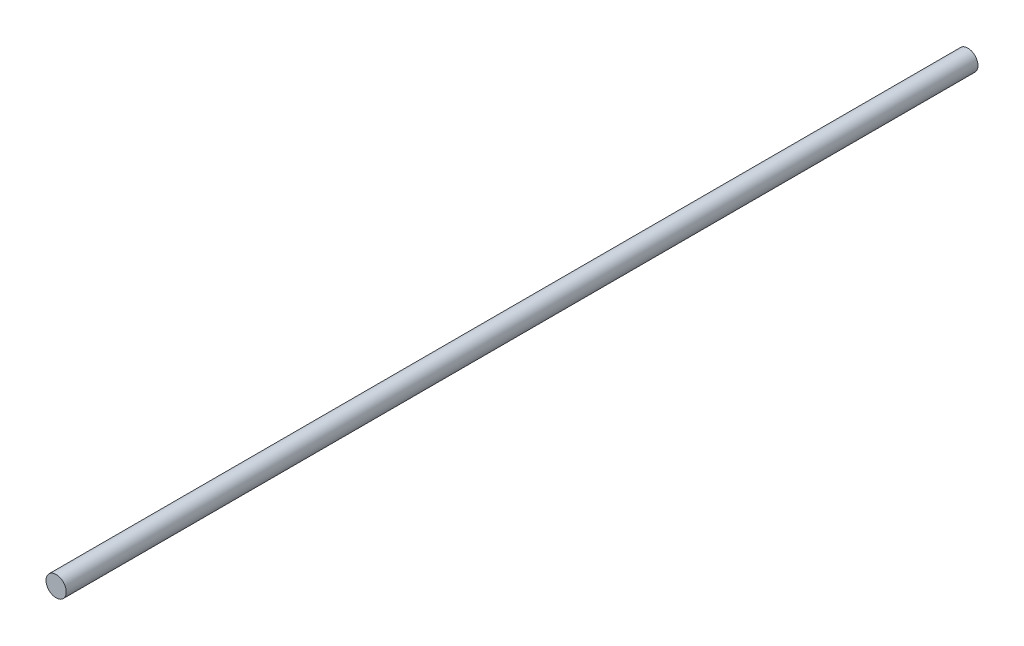
from build123d import *

# Parameters (mm, degrees)
SKETCH2_R           = 5
BOSS_EXTRUDE1_DEPTH = 450


with BuildPart() as part:
    # Sketch2 → Boss-Extrude1 (new body)
    with BuildSketch(Plane.XY):
        with Locations((-13.668091063, 264.459434398)):
            Circle(SKETCH2_R)
    extrude(amount=BOSS_EXTRUDE1_DEPTH)


solid = part.part
